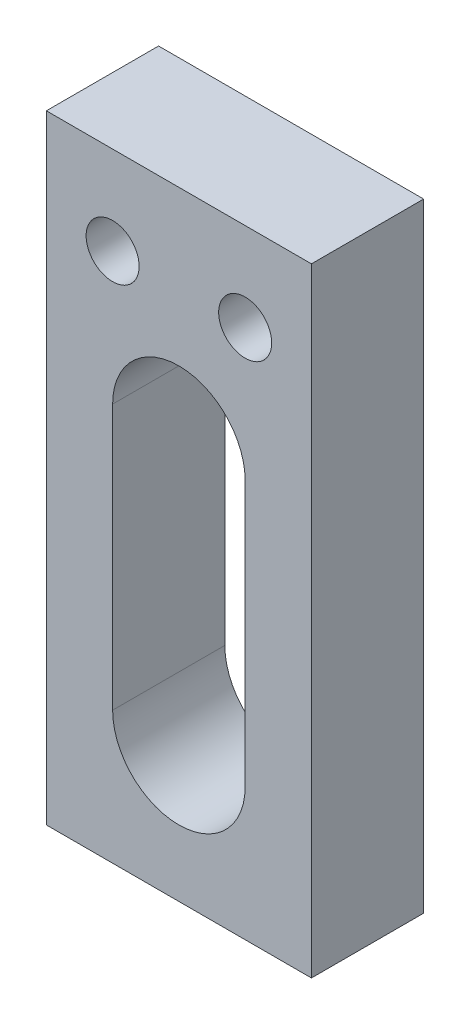
from build123d import *

# Parameters (mm, degrees)
CROQUIS1_W              = 30
CROQUIS1_H              = 70
CROQUIS1_R              = 3
SALIENTE_EXTRUIR1_DEPTH = 12.7


with BuildPart() as part:
    # Croquis1 → Saliente-Extruir1 (new body)
    with BuildSketch(Plane.XY):
        Rectangle(CROQUIS1_W, CROQUIS1_H)
        with Locations((-7.5, 25)):
            Circle(CROQUIS1_R, mode=Mode.SUBTRACT)
        with Locations((7.5, 25)):
            Circle(CROQUIS1_R, mode=Mode.SUBTRACT)
        with BuildLine():
            Line((7.5, 10), (7.5, -20))
            ThreePointArc((7.5, -20), (0, -27.5), (-7.5, -20))
            Line((-7.5, -20), (-7.5, 10))
            ThreePointArc((-7.5, 10), (0, 17.5), (7.5, 10))
        make_face(mode=Mode.SUBTRACT)
    extrude(amount=SALIENTE_EXTRUIR1_DEPTH)


solid = part.part
